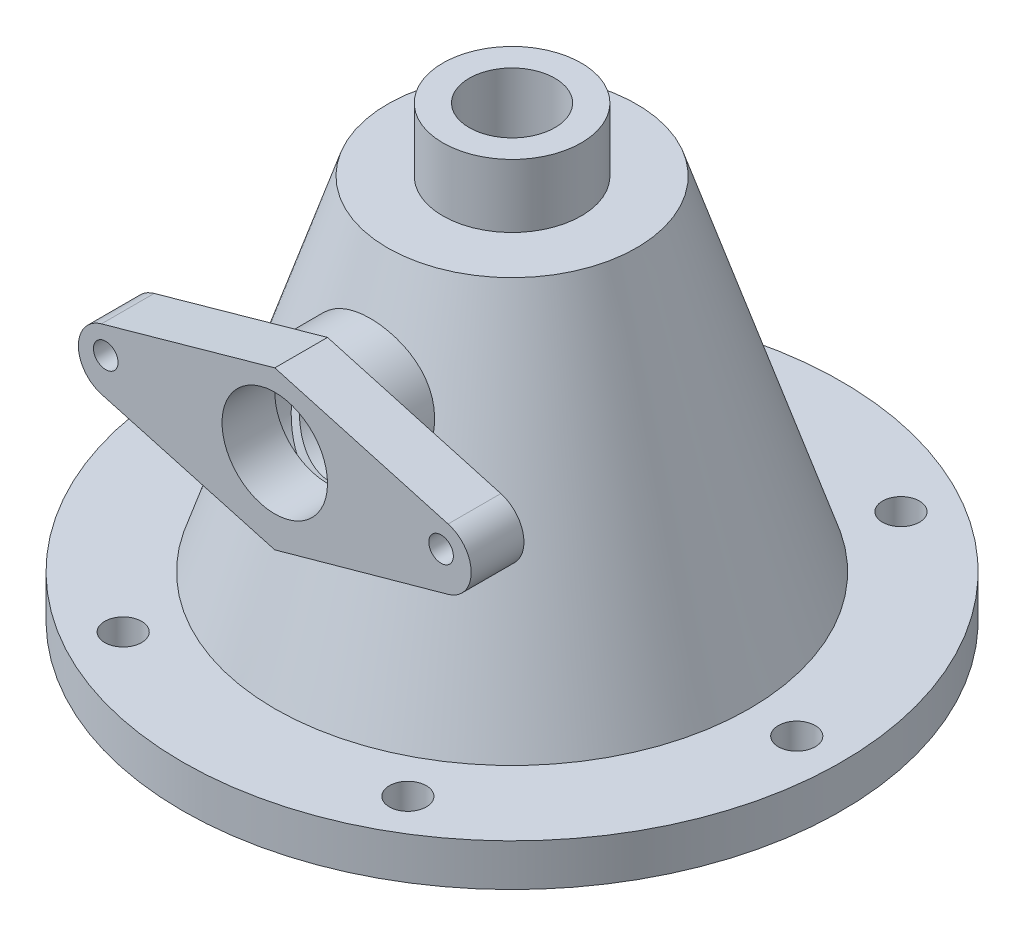
from build123d import *

# Parameters (mm, degrees)
SKETCH_2_R                      = 10
EXTRUDE_2_DEPTH                 = 45
EXTRUDE_START                   = -10
SKETCH_4_R                      = 10
EXTRUDE_4_DEPTH                 = 10
SKETCH_2_2_R                    = 10
CUT_EXTRUDE_1_DEPTH             = 117.85038305
EXTRUDE_5_REACH                 = 147.959
SKETCH_5_R                      = 13.058341014
SKETCH_5_R_2                    = 12
CUT_EXTRUDE_2_REACH             = 147.959
SKETCH_8_R                      = 2.33230382
CUT_EXTRUDE_2_DIRECTION_2_DEPTH = 146.958939497
CUT_EXTRUDE_3_REACH             = 118.85
SKETCH_9_R                      = 3.5


with BuildPart() as part:
    # 草图1 → 旋转1 (revolve)
    with BuildSketch(Plane.XY, mode=Mode.PRIVATE) as revolve_1_sk:
        Polygon((-8.127581033, 76.429784894), (-8.127581033, 59.429784894), (-20, 59.429784894), (-42.367966888, -8.570215106), (-62.5, -8.570215106), (-62.5, -0.570215106), (-45, -0.570215106), (-25.027243731, 60.148196767), (-23.61885518, 64.429784894), (-13.127581033, 64.429784894), (-13.127581033, 76.429784894), align=None)
    revolve(revolve_1_sk.sketch.rotate(Axis((0, 0, 0), (0, -1, 0)), 270), axis=Axis((0, 0, 0), (0, -1, 0)))

    # 草图2 → 凸台-拉伸2 (add)
    with BuildSketch(Plane.XY):
        with Locations(Location((0, 41.429784894, 0), (0, 0, 221.869851272))):
            Circle(SKETCH_2_R)
    extrude(amount=EXTRUDE_2_DEPTH)

    # 草图4 → 凸台-拉伸4 (add)
    with BuildSketch(Plane.XY.offset(45).offset(EXTRUDE_START)):
        with Locations(Location((0, 41.429784894, 0), (0, 0, 221.869851272))):
            Circle(SKETCH_4_R)
        with BuildLine():
            Line((0, 55.419685687), (-32.868994798, 46.212925364))
            ThreePointArc((-32.868994798, 46.212925364), (-37.250650309, 40.428422584), (-32.855748679, 34.653977409))
            Line((-32.855748679, 34.653977409), (0, 25.532086459))
            Line((0, 25.532086459), (0, 41.429784894))
            Line((0, 41.429784894), (0, 55.419685687))
        make_face()
        with BuildLine():
            ThreePointArc((32.868994798, 46.212925364), (37.250650309, 40.428422584), (32.855748679, 34.653977409))
            Line((32.855748679, 34.653977409), (0, 25.532086459))
            Line((0, 25.532086459), (0, 41.429784894))
            Line((0, 41.429784894), (0, 55.419685687))
            Line((0, 55.419685687), (32.868994798, 46.212925364))
        make_face()
    extrude(amount=EXTRUDE_4_DEPTH)

    # 草图2<2> → 切除-拉伸1 (cut, through all)
    with BuildSketch(Plane.XY):
        with Locations((0, 41.429784894)):
            Circle(SKETCH_2_2_R)
    extrude(amount=CUT_EXTRUDE_1_DEPTH, mode=Mode.SUBTRACT)

    # 草图5 → 凸台-拉伸5 (add, up to next)
    with BuildSketch(Plane.XY.offset(45), mode=Mode.PRIVATE) as extrude_5_sk1:
        with Locations((0, 41.429784894)):
            Circle(SKETCH_5_R)
        with Locations((0, 41.429784894)):
            Circle(SKETCH_5_R_2, mode=Mode.SUBTRACT)
    extrude_5_tool1 = extrude(extrude_5_sk1.sketch, amount=-EXTRUDE_5_REACH, mode=Mode.PRIVATE) - part.part
    add(extrude_5_tool1.solids().sort_by_distance((-12.688995, 41.429785, 45))[0])

    # 草图8 → 切除-拉伸2 (cut, up to next)
    with BuildSketch(Plane.XY.offset(45), mode=Mode.PRIVATE) as cut_extrude_2_sk1:
        with Locations((-32.054895546, 41.429784894)):
            Circle(SKETCH_8_R)
    cut_extrude_2_tool1 = extrude(cut_extrude_2_sk1.sketch, amount=-CUT_EXTRUDE_2_REACH, mode=Mode.PRIVATE) & part.part
    # 草图8 → 切除-拉伸2 (cut, up to next)
    with BuildSketch(Plane.XY.offset(45), mode=Mode.PRIVATE) as cut_extrude_2_sk2:
        with Locations((31.532261379, 41.429784894)):
            Circle(SKETCH_8_R)
    cut_extrude_2_tool2 = extrude(cut_extrude_2_sk2.sketch, amount=-CUT_EXTRUDE_2_REACH, mode=Mode.PRIVATE) & part.part
    add(cut_extrude_2_tool1.solids().sort_by_distance((-32.054896, 41.429785, 45))[0], mode=Mode.SUBTRACT)
    add(cut_extrude_2_tool2.solids().sort_by_distance((31.532261, 41.429785, 45))[0], mode=Mode.SUBTRACT)

    # 草图8 → 切除-拉伸2 direction 2 (cut)
    with BuildSketch(Plane.XY.offset(45)):
        with Locations((-32.054895546, 41.429784894)):
            Circle(SKETCH_8_R)
        with Locations((31.532261379, 41.429784894)):
            Circle(SKETCH_8_R)
    extrude(amount=CUT_EXTRUDE_2_DIRECTION_2_DEPTH, mode=Mode.SUBTRACT)

    # 草图9 → 切除-拉伸3 (cut, up to next)
    with BuildSketch(Plane(origin=(0, 0, 0), x_dir=(1, 0, 0), z_dir=(0, 1, 0)), mode=Mode.PRIVATE) as cut_extrude_3_sk1:
        with Locations(Location((-53.988745261, 0, 0), (0, 0, 270))):
            Circle(SKETCH_9_R)
    cut_extrude_3_tool1 = extrude(cut_extrude_3_sk1.sketch, amount=-CUT_EXTRUDE_3_REACH, mode=Mode.PRIVATE) & part.part
    # 草图9 → 切除-拉伸3 (cut, up to next)
    with BuildSketch(Plane(origin=(0, 0, 0), x_dir=(1, 0, 0), z_dir=(0, 1, 0)), mode=Mode.PRIVATE) as cut_extrude_3_sk2:
        with Locations(Location((-26.994372631, 46.755624915, 0), (0, 0, 270))):
            Circle(SKETCH_9_R)
    cut_extrude_3_tool2 = extrude(cut_extrude_3_sk2.sketch, amount=-CUT_EXTRUDE_3_REACH, mode=Mode.PRIVATE) & part.part
    # 草图9 → 切除-拉伸3 (cut, up to next)
    with BuildSketch(Plane(origin=(0, 0, 0), x_dir=(1, 0, 0), z_dir=(0, 1, 0)), mode=Mode.PRIVATE) as cut_extrude_3_sk3:
        with Locations(Location((26.994372631, 46.755624915, 0), (0, 0, 270))):
            Circle(SKETCH_9_R)
    cut_extrude_3_tool3 = extrude(cut_extrude_3_sk3.sketch, amount=-CUT_EXTRUDE_3_REACH, mode=Mode.PRIVATE) & part.part
    # 草图9 → 切除-拉伸3 (cut, up to next)
    with BuildSketch(Plane(origin=(0, 0, 0), x_dir=(1, 0, 0), z_dir=(0, 1, 0)), mode=Mode.PRIVATE) as cut_extrude_3_sk4:
        with Locations(Location((53.988745261, 0, 0), (0, 0, 270))):
            Circle(SKETCH_9_R)
    cut_extrude_3_tool4 = extrude(cut_extrude_3_sk4.sketch, amount=-CUT_EXTRUDE_3_REACH, mode=Mode.PRIVATE) & part.part
    # 草图9 → 切除-拉伸3 (cut, up to next)
    with BuildSketch(Plane(origin=(0, 0, 0), x_dir=(1, 0, 0), z_dir=(0, 1, 0)), mode=Mode.PRIVATE) as cut_extrude_3_sk5:
        with Locations(Location((26.994372631, -46.755624915, 0), (0, 0, 270))):
            Circle(SKETCH_9_R)
    cut_extrude_3_tool5 = extrude(cut_extrude_3_sk5.sketch, amount=-CUT_EXTRUDE_3_REACH, mode=Mode.PRIVATE) & part.part
    # 草图9 → 切除-拉伸3 (cut, up to next)
    with BuildSketch(Plane(origin=(0, 0, 0), x_dir=(1, 0, 0), z_dir=(0, 1, 0)), mode=Mode.PRIVATE) as cut_extrude_3_sk6:
        with Locations(Location((-26.994372631, -46.755624915, 0), (0, 0, 270))):
            Circle(SKETCH_9_R)
    cut_extrude_3_tool6 = extrude(cut_extrude_3_sk6.sketch, amount=-CUT_EXTRUDE_3_REACH, mode=Mode.PRIVATE) & part.part
    add(cut_extrude_3_tool1.solids().sort_by_distance((-53.988745, 0, 0))[0], mode=Mode.SUBTRACT)
    add(cut_extrude_3_tool2.solids().sort_by_distance((-26.994373, 0, -46.755625))[0], mode=Mode.SUBTRACT)
    add(cut_extrude_3_tool3.solids().sort_by_distance((26.994373, 0, -46.755625))[0], mode=Mode.SUBTRACT)
    add(cut_extrude_3_tool4.solids().sort_by_distance((53.988745, 0, 0))[0], mode=Mode.SUBTRACT)
    add(cut_extrude_3_tool5.solids().sort_by_distance((26.994373, 0, 46.755625))[0], mode=Mode.SUBTRACT)
    add(cut_extrude_3_tool6.solids().sort_by_distance((-26.994373, 0, 46.755625))[0], mode=Mode.SUBTRACT)


solid = part.part
